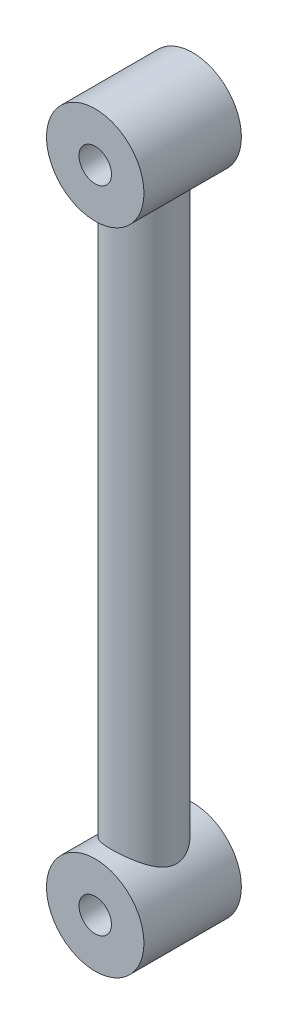
from build123d import *

# Parameters (mm, degrees)
SKETCH_1_R           = 1.5
SKETCH_1_R_2         = 0.5
EXTRUDE_1_DEPTH      = 3
EXTRUDE_2_REACH      = 13.979
EXTRUDE_2_END_RADIUS = 1.5
SKETCH_2_R           = 1


with BuildPart() as part:
    # 草图1 → 凸台-拉伸1 (new body)
    with BuildSketch(Plane.XY):
        Circle(SKETCH_1_R)
        Circle(SKETCH_1_R_2, mode=Mode.SUBTRACT)
    extrude_1 = extrude(amount=EXTRUDE_1_DEPTH)

    # 凸台-拉伸2: up to this cylinder (the profile starts outside it)
    extrude_2_end = Plane(origin=(0, 0, 1.5), z_dir=(0, 0, -1)) * Cylinder(EXTRUDE_2_END_RADIUS, 31.958, mode=Mode.PRIVATE)
    # 草图2 → 凸台-拉伸2 (add, up to the surface)
    with BuildSketch(Plane(origin=(0, 10, 0), x_dir=(1, 0, 0), z_dir=(0, 1, 0)), mode=Mode.PRIVATE) as extrude_2_sk1:
        with Locations(Location((0, -1.5, 0), (0, 0, 270))):
            Circle(SKETCH_2_R)
    extrude_2_tool1 = extrude(extrude_2_sk1.sketch, amount=-EXTRUDE_2_REACH, mode=Mode.PRIVATE) - extrude_2_end
    extrude_2 = extrude_2_tool1.solids().sort_by_distance((0, 10, 1.5))[0]
    add(extrude_2)

    # 镜向1: 凸台-拉伸2 across plane
    add(extrude_2.mirror(Plane.ZX.offset(10)))

    # 镜向2: 凸台-拉伸1 across plane
    add(extrude_1.mirror(Plane.ZX.offset(10)))


solid = part.part
